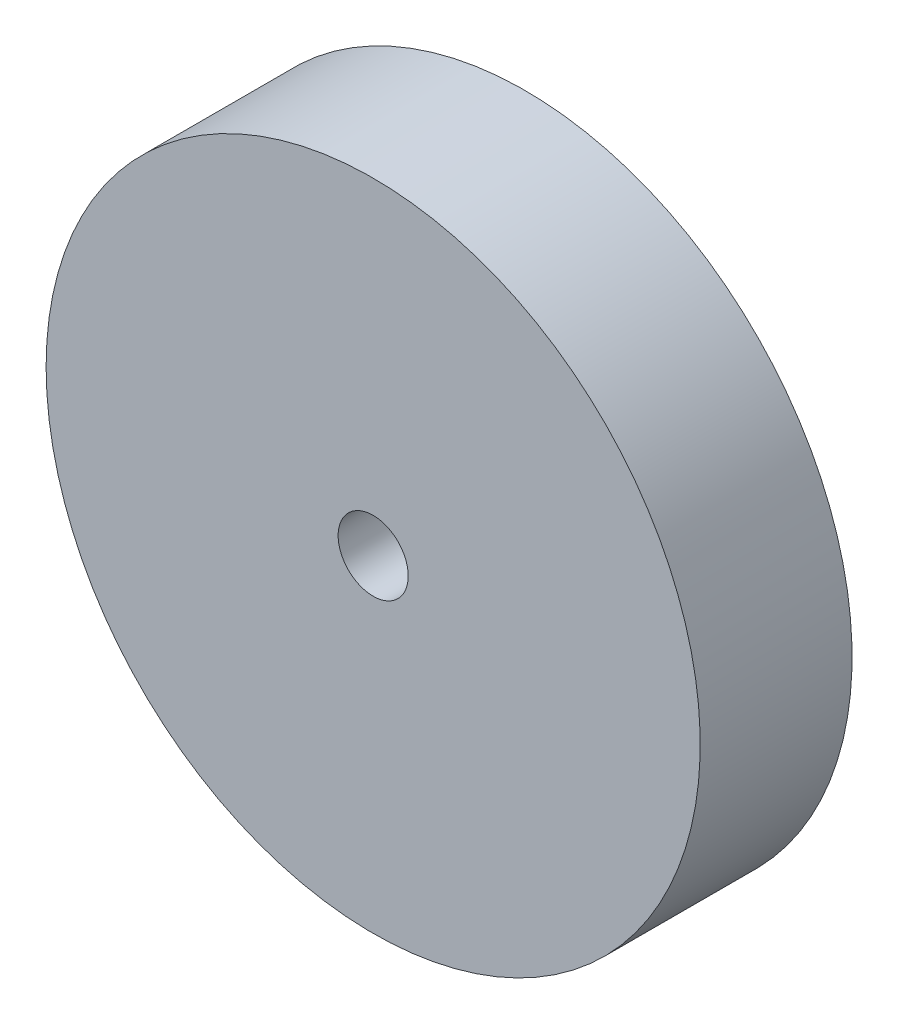
from build123d import *

# Parameters (mm, degrees)
ESQUISSE1_R             = 28
BOSS_EXTRU_1_DEPTH      = 13
ESQUISSE2_R             = 3
ENL_V_MAT_EXTRU_1_DEPTH = 42.677331968


with BuildPart() as part:
    # Esquisse1 → Boss.-Extru.1 (new body)
    with BuildSketch(Plane.XY):
        with Locations(Location((0, 0, 0), (0, 0, 180))):
            Circle(ESQUISSE1_R)
    extrude(amount=BOSS_EXTRU_1_DEPTH)

    # Esquisse2 → Enlèv. mat.-Extru.1 (cut, through all)
    with BuildSketch(Plane.XY.offset(13)):
        Circle(ESQUISSE2_R)
    extrude(amount=-ENL_V_MAT_EXTRU_1_DEPTH, mode=Mode.SUBTRACT)


solid = part.part
